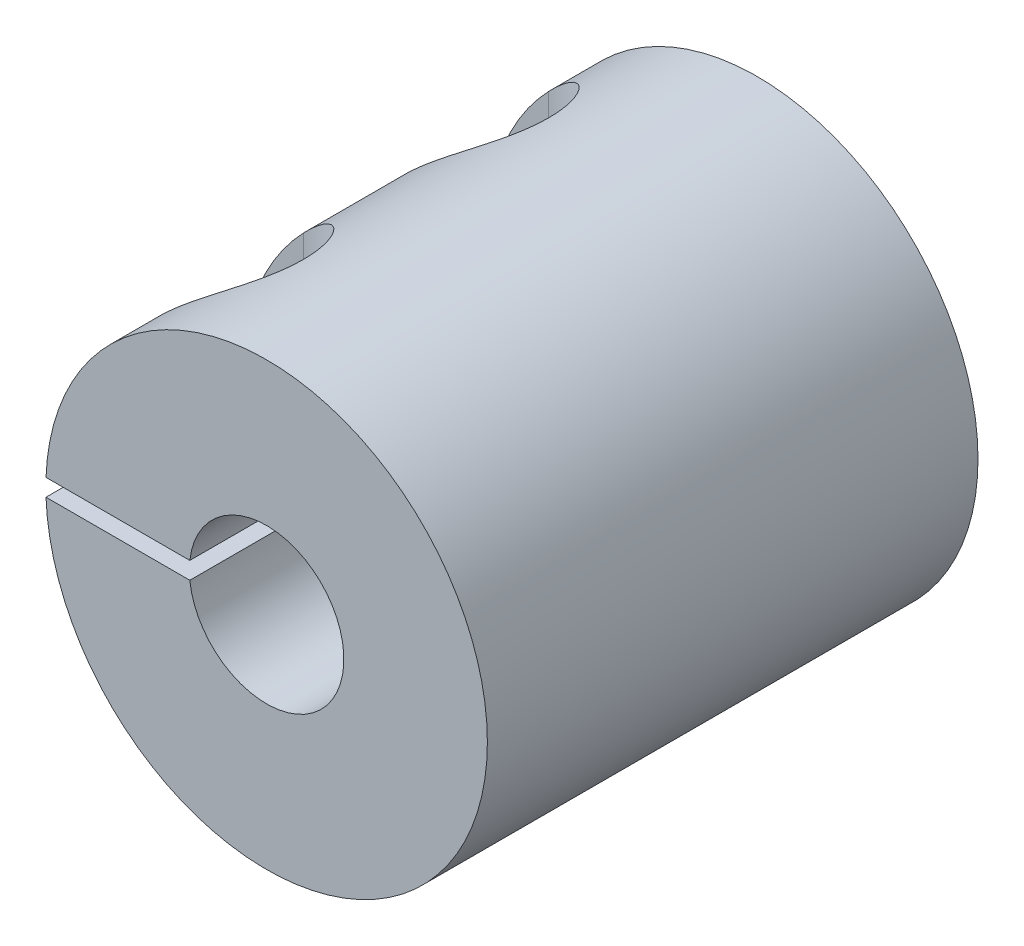
from build123d import *

# Parameters (mm, degrees)
SKETCH_1_R          = 9
EXTRUDE_1_DEPTH     = 20
SKETCH_2_R          = 3.15
CUT_EXTRUDE_1_DEPTH = 24.706539182
SKETCH_3_R          = 4
CUT_EXTRUDE_2_DEPTH = 10
SKETCH_4_W          = 11.134080052
SKETCH_4_H          = 0.7
CUT_EXTRUDE_3_DEPTH = 24.706539182
CUT_EXTRUDE_4_DEPTH = 25.928347318
SKETCH_6_R          = 1.5
CUT_EXTRUDE_5_DEPTH = 2.5
SKETCH_7_R          = 1.25
CUT_EXTRUDE_6_DEPTH = 24.841612942


with BuildPart() as part:
    # Эскиз1 → Бобышка-Вытянуть1 (new body)
    with BuildSketch(Plane.XY):
        Circle(SKETCH_1_R)
    extrude(amount=EXTRUDE_1_DEPTH)

    # Эскиз2 → Вырез-Вытянуть1 (cut, through all)
    with BuildSketch(Plane.XY.offset(20)):
        Circle(SKETCH_2_R)
    extrude(amount=-CUT_EXTRUDE_1_DEPTH, mode=Mode.SUBTRACT)

    # Эскиз3 → Вырез-Вытянуть2 (cut)
    with BuildSketch(Plane(origin=(0, 0, 0), x_dir=(-1, 0, 0), z_dir=(0, 0, -1))):
        Circle(SKETCH_3_R)
    extrude(amount=-CUT_EXTRUDE_2_DEPTH, mode=Mode.SUBTRACT)

    # Эскиз4 → Вырез-Вытянуть3 (cut, through all)
    with BuildSketch(Plane(origin=(0, 0, 0), x_dir=(-1, 0, 0), z_dir=(0, 0, -1))):
        with Locations((7.860965997, 0)):
            Rectangle(SKETCH_4_W, SKETCH_4_H)
    extrude(amount=-CUT_EXTRUDE_3_DEPTH, mode=Mode.SUBTRACT)

    # Эскиз5 → Вырез-Вытянуть4 (cut, through all)
    with BuildSketch(Plane(origin=(0, 2.85, 0), x_dir=(-1, 0, 0), z_dir=(0, -1, 0))):
        with BuildLine():
            Line((6.5, -2), (11.780255313, -2))
            Line((11.780255313, -2), (11.780255313, -8))
            Line((11.780255313, -8), (6.5, -8))
            ThreePointArc((6.5, -8), (3.5, -5), (6.5, -2))
        make_face()
        with BuildLine():
            Line((6.5, -12), (11.780255313, -12))
            Line((11.780255313, -12), (11.780255313, -18))
            Line((11.780255313, -18), (6.5, -18))
            ThreePointArc((6.5, -18), (3.5, -15), (6.5, -12))
        make_face()
    extrude(amount=-CUT_EXTRUDE_4_DEPTH, mode=Mode.SUBTRACT)

    # Эскиз6 → Вырез-Вытянуть5 (cut)
    with BuildSketch(Plane(origin=(0, 2.85, 0), x_dir=(1, 0, 0), z_dir=(0, 1, 0))):
        with Locations(Location((-6.5, -5, 0), (0, 0, 270))):
            Circle(SKETCH_6_R)
        with Locations(Location((-6.5, -15, 0), (0, 0, 270))):
            Circle(SKETCH_6_R)
    extrude(amount=-CUT_EXTRUDE_5_DEPTH, mode=Mode.SUBTRACT)

    # Эскиз7 → Вырез-Вытянуть6 (cut, through all)
    with BuildSketch(Plane(origin=(0, -0.35, 0), x_dir=(1, 0, 0), z_dir=(0, 1, 0))):
        with Locations(Location((-6.5, -5, 0), (0, 0, 270))):
            Circle(SKETCH_7_R)
        with Locations(Location((-6.5, -15, 0), (0, 0, 270))):
            Circle(SKETCH_7_R)
    extrude(amount=-CUT_EXTRUDE_6_DEPTH, mode=Mode.SUBTRACT)


solid = part.part
